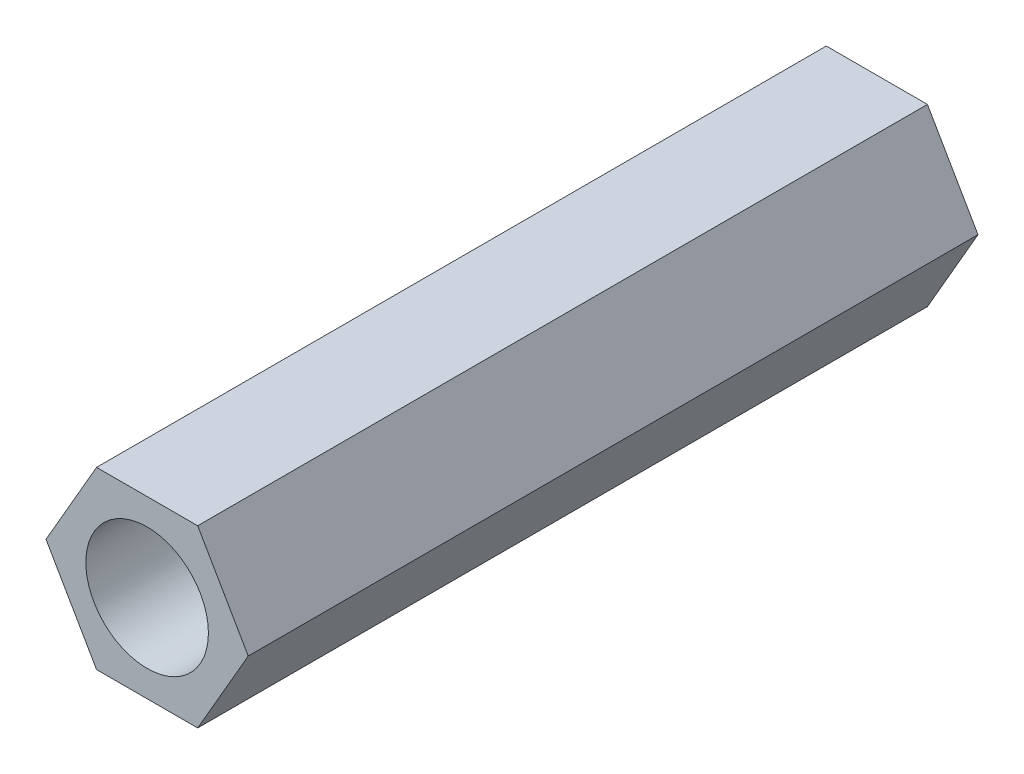
from build123d import *

# Parameters (mm, degrees)
SKETCH_1_R      = 2.1
EXTRUDE_1_DEPTH = 25


with BuildPart() as part:
    # 草图1 → 凸台-拉伸1 (new body)
    with BuildSketch(Plane.XY):
        Polygon((1.732050808, 3), (-1.732050808, 3), (-3.464101615, 0), (-1.732050808, -3), (1.732050808, -3), (3.464101615, 0), align=None)
        Circle(SKETCH_1_R, mode=Mode.SUBTRACT)
    extrude(amount=EXTRUDE_1_DEPTH)


solid = part.part
